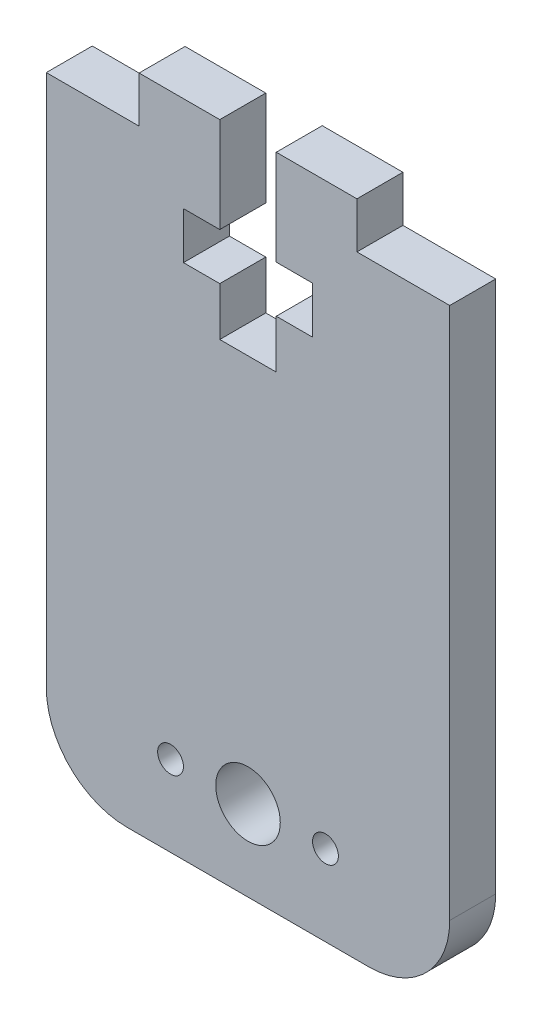
from build123d import *

# Parameters (mm, degrees)
SKETCH1_W           = 25
SKETCH1_H           = 38
BOSS_EXTRUDE1_DEPTH = 1.425
SKETCH2_R           = 2
CUT_EXTRUDE1_DEPTH  = 23.92100565
SKETCH3_R           = 0.8
CUT_EXTRUDE2_DEPTH  = 23.92100565
SKETCH4_W           = 5
SKETCH4_H           = 2.85
BOSS_EXTRUDE2_DEPTH = 2.85
SKETCH5_W           = 8
SKETCH5_H           = 2.9
CUT_EXTRUDE3_DEPTH  = 26.333673243
SKETCH6_W           = 3.5
SKETCH6_H           = 8.95
CUT_EXTRUDE4_DEPTH  = 26.333673243
FILLET1_R           = 5


with BuildPart() as part:
    # Sketch1 → Boss-Extrude1 (new, symmetric)
    with BuildSketch(Plane.XY):
        Rectangle(SKETCH1_W, SKETCH1_H)
    extrude(amount=BOSS_EXTRUDE1_DEPTH, both=True)

    # Sketch2 → Cut-Extrude1 (cut, through all)
    with BuildSketch(Plane.XY.offset(1.425)):
        with Locations((0, -14)):
            Circle(SKETCH2_R)
    extrude(amount=-CUT_EXTRUDE1_DEPTH, mode=Mode.SUBTRACT)

    # Sketch3 → Cut-Extrude2 (cut, through all)
    with BuildSketch(Plane.XY.offset(1.425)):
        with Locations((-4.8, -14)):
            Circle(SKETCH3_R)
        with Locations((4.8, -14)):
            Circle(SKETCH3_R)
    extrude(amount=-CUT_EXTRUDE2_DEPTH, mode=Mode.SUBTRACT)

    # Sketch4 → Boss-Extrude2 (add)
    with BuildSketch(Plane.XY.offset(1.425)):
        with Locations((-4.25, 20.425)):
            Rectangle(SKETCH4_W, SKETCH4_H)
        with Locations((4.25, 20.425)):
            Rectangle(SKETCH4_W, SKETCH4_H)
    extrude(amount=-BOSS_EXTRUDE2_DEPTH)

    # Sketch5 → Cut-Extrude3 (cut, through all)
    with BuildSketch(Plane.XY.offset(1.425)):
        with Locations((0, 14.5)):
            Rectangle(SKETCH5_W, SKETCH5_H)
    extrude(amount=-CUT_EXTRUDE3_DEPTH, mode=Mode.SUBTRACT)

    # Sketch6 → Cut-Extrude4 (cut, through all)
    with BuildSketch(Plane.XY.offset(1.425)):
        with Locations((0, 14.525)):
            Rectangle(SKETCH6_W, SKETCH6_H)
    extrude(amount=-CUT_EXTRUDE4_DEPTH, mode=Mode.SUBTRACT)

    # Fillet1
    fillet1_edges = [part.edges().sort_by_distance(p)[0] for p in [
        (12.5, -19, 0),
        (-12.5, -19, 0),
    ]]
    fillet(fillet1_edges, radius=FILLET1_R)


solid = part.part
